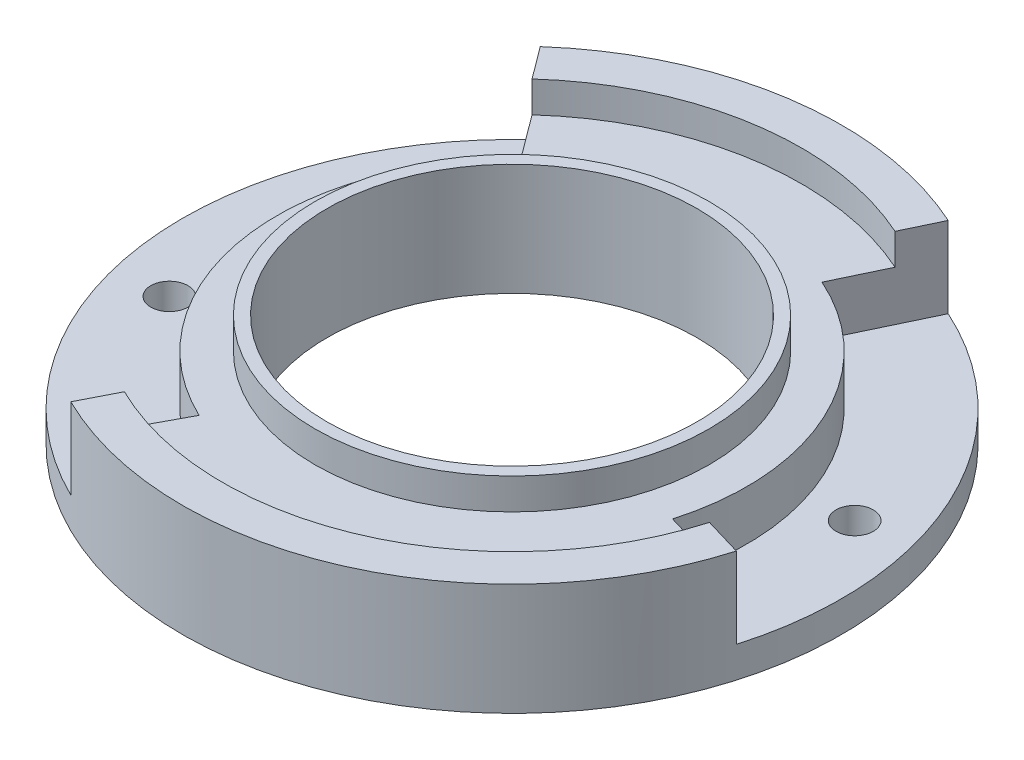
from build123d import *

# Parameters (mm, degrees)
ESQUISSE1_R                = 26.506823587
ESQUISSE1_R_2              = 14.875
BOSS_EXTRU_1_DEPTH         = 5
ESQUISSE2_R                = 23.3
ESQUISSE2_R_2              = 15.85
ENL_V_MAT_EXTRU_1_DEPTH    = 2.5
SKETCH1_R                  = 26.506823587
BOSS_EXTRUDE1_DEPTH        = 50
CUT_EXTRUDE6_START         = -46
SKETCH10_R                 = 26.506823587
CUT_EXTRUDE6_DEPTH         = 46
CUT_EXTRUDE7_START         = 23
CUT_EXTRUDE7_DEPTH         = 23
CUT_EXTRUDE8_DEPTH         = 4
SKETCH13_R                 = 14.875
CUT_EXTRUDE9_DEPTH         = 10
TROUS_DE_CENTRAGE_3_0MM1_D = 3


with BuildPart() as part:
    # Esquisse1 → Boss.-Extru.1 (new body)
    with BuildSketch(Plane(origin=(0, 0, 0), x_dir=(1, 0, 0), z_dir=(0, 1, 0))):
        Circle(ESQUISSE1_R)
        Circle(ESQUISSE1_R_2, mode=Mode.SUBTRACT)
    extrude(amount=-BOSS_EXTRU_1_DEPTH)

    # Esquisse2 → Enlèv. mat.-Extru.1 (cut)
    with BuildSketch(Plane(origin=(0, 0, 0), x_dir=(1, 0, 0), z_dir=(0, 1, 0))):
        Circle(ESQUISSE2_R)
        Circle(ESQUISSE2_R_2, mode=Mode.SUBTRACT)
    extrude(amount=-ENL_V_MAT_EXTRU_1_DEPTH, mode=Mode.SUBTRACT)

    # Sketch1 → Boss-Extrude1 (add)
    with BuildSketch(Plane.XZ.offset(5)):
        Circle(SKETCH1_R)
    extrude(amount=BOSS_EXTRUDE1_DEPTH)

    # Sketch10 → Cut-Extrude6 (cut)
    with BuildSketch(Plane.XZ.offset(55).offset(CUT_EXTRUDE6_START)):
        Circle(SKETCH10_R)
    extrude(amount=CUT_EXTRUDE6_DEPTH, mode=Mode.SUBTRACT)

    # Sketch11 → Cut-Extrude7 (cut)
    with BuildSketch(Plane(origin=(0, -2.5, 0), x_dir=(1, 0, 0), z_dir=(0, 1, 0)).offset(CUT_EXTRUDE7_START)):
        with BuildLine():
            ThreePointArc((3.089292847, -15.546021025), (-7.106964395, -14.192172687), (-14.298787433, -6.838653226))
            ThreePointArc((-14.298787433, -6.838653226), (-15.6186236, 2.698350765), (-11.17547923, 11.239713697))
            Line((-11.17547923, 11.239713697), (-18.357041818, 20.900818346))
            ThreePointArc((-18.357041818, 20.900818346), (-27.289505672, -3.550750304), (-12.221843482, -24.778884374))
            Line((-12.221843482, -24.778884374), (-10.256093613, -20.921341826))
            ThreePointArc((-10.256093613, -20.921341826), (9.421496674, -21.310218216), (22.376731607, -6.493988189))
            Line((22.376731607, -6.493988189), (27.230046935, -7.935538889))
            ThreePointArc((27.230046935, -7.935538889), (25.871646158, 11.865956721), (11.723526474, 25.786272467))
            Line((11.723526474, 25.786272467), (6.35639752, 14.519597466))
            ThreePointArc((6.35639752, 14.519597466), (7.430217711, 14.000513018), (8.46196456, 13.402151163))
            ThreePointArc((8.46196456, 13.402151163), (14.880283403, 6.412842881), (15.55329147, -3.052478411))
            ThreePointArc((15.55329147, -3.052478411), (11.220901892, -11.194367366), (3.089292847, -15.546021025))
        make_face()
    extrude(amount=-CUT_EXTRUDE7_DEPTH, mode=Mode.SUBTRACT)

    # Sketch12 → Cut-Extrude8 (cut)
    with BuildSketch(Plane(origin=(0, -2.5, 0), x_dir=(1, 0, 0), z_dir=(0, 1, 0))):
        with BuildLine():
            Line((-17.572262491, 19.845082201), (-13.005635601, 13.70175897))
            ThreePointArc((-13.005635601, 13.70175897), (-18.656508539, -2.969755104), (-8.108525171, -17.062724747))
            Line((-8.108525171, -17.062724747), (-11.712252125, -23.77887396))
            ThreePointArc((-11.712252125, -23.77887396), (-26.270860033, -3.528967239), (-17.572262491, 19.845082201))
        make_face()
        with BuildLine():
            Line((10.940944201, 24.143476068), (7.664960465, 17.26653229))
            ThreePointArc((7.664960465, 17.26653229), (17.123986027, 7.978336844), (18.150504226, -5.238697604))
            Line((18.150504226, -5.238697604), (25.450871211, -7.407081157))
            ThreePointArc((25.450871211, -7.407081157), (24.082160878, 11.075252778), (10.940944201, 24.143476068))
        make_face()
    extrude(amount=-CUT_EXTRUDE8_DEPTH, mode=Mode.SUBTRACT)

    # Sketch13 → Cut-Extrude9 (cut)
    with BuildSketch(Plane(origin=(0, -5, 0), x_dir=(1, 0, 0), z_dir=(0, 1, 0))):
        Circle(SKETCH13_R)
    extrude(amount=-CUT_EXTRUDE9_DEPTH, mode=Mode.SUBTRACT)

    # Trous de centrage Ø3.0mm1 (through all)
    with Locations(Plane(origin=(0, -6.5, 0), x_dir=(1, 0, 0), z_dir=(0, 1, 0))):
        with Locations((-21.589234965, -5.972012529), (21.589234965, 5.972012529)):
            Hole(TROUS_DE_CENTRAGE_3_0MM1_D / 2)


solid = part.part
